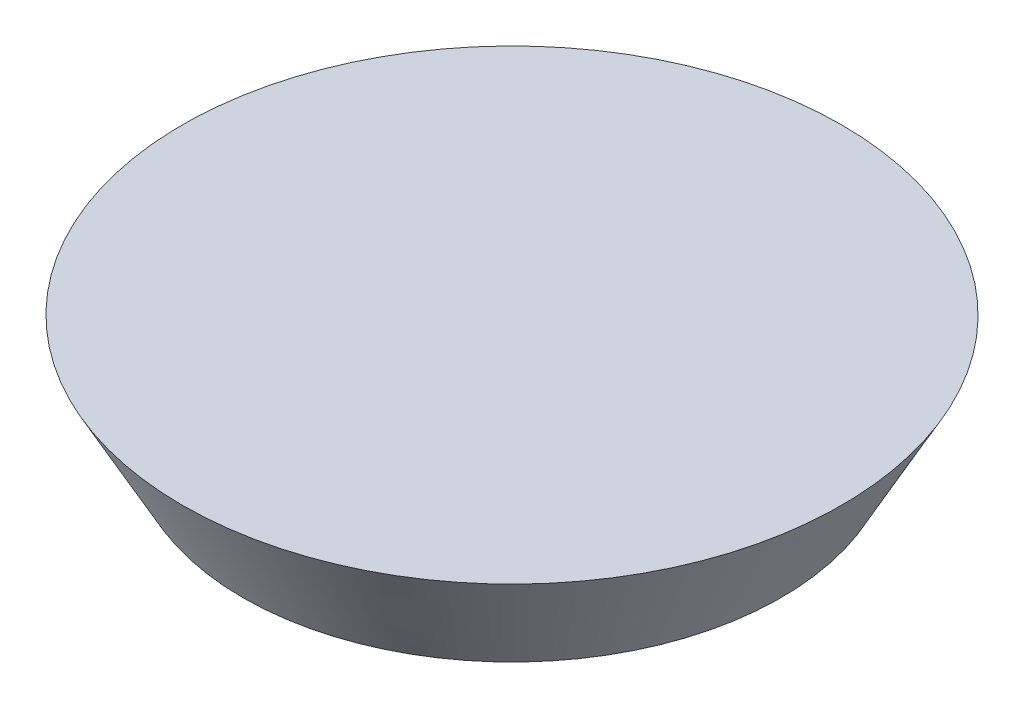
from build123d import *


with BuildPart() as part:
    # Sketch2 → Revolve1 (revolve)
    with BuildSketch(Plane.XY, mode=Mode.PRIVATE) as revolve1_sk:
        Polygon((0, 0), (-10, 0), (-12.25, 4.1), (0, 4.1), align=None)
    revolve(revolve1_sk.sketch.rotate(Axis((0, 0, 0), (0, -1, 0)), 270), axis=Axis((0, 0, 0), (0, -1, 0)))


solid = part.part
